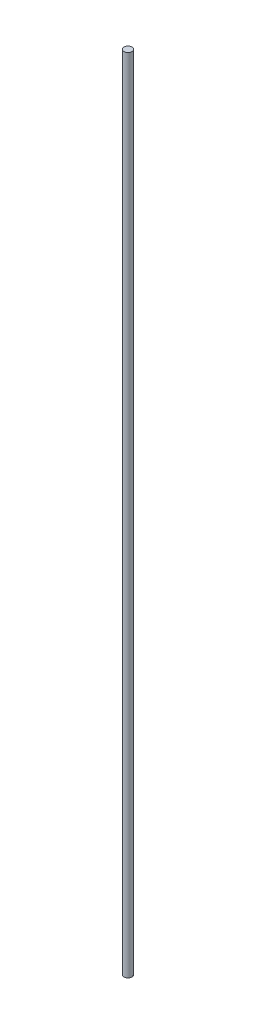
from build123d import *

# Parameters (mm, degrees)
BOSS_EXTRUDE1_DEPTH      = 400
BOSS_EXTRUDE1_DEPTH_BACK = 400
SKETCH1_R                = 4


with BuildPart() as part:
    # Sketch1 → Boss-Extrude1 (new, two sides: drawn at the far end of the back side and taken through both)
    with BuildSketch(Plane(origin=(0, 0, 0), x_dir=(1, 0, 0), z_dir=(0, 1, 0)).offset(-BOSS_EXTRUDE1_DEPTH_BACK)):
        Circle(SKETCH1_R)
    extrude(amount=BOSS_EXTRUDE1_DEPTH + BOSS_EXTRUDE1_DEPTH_BACK)


solid = part.part
